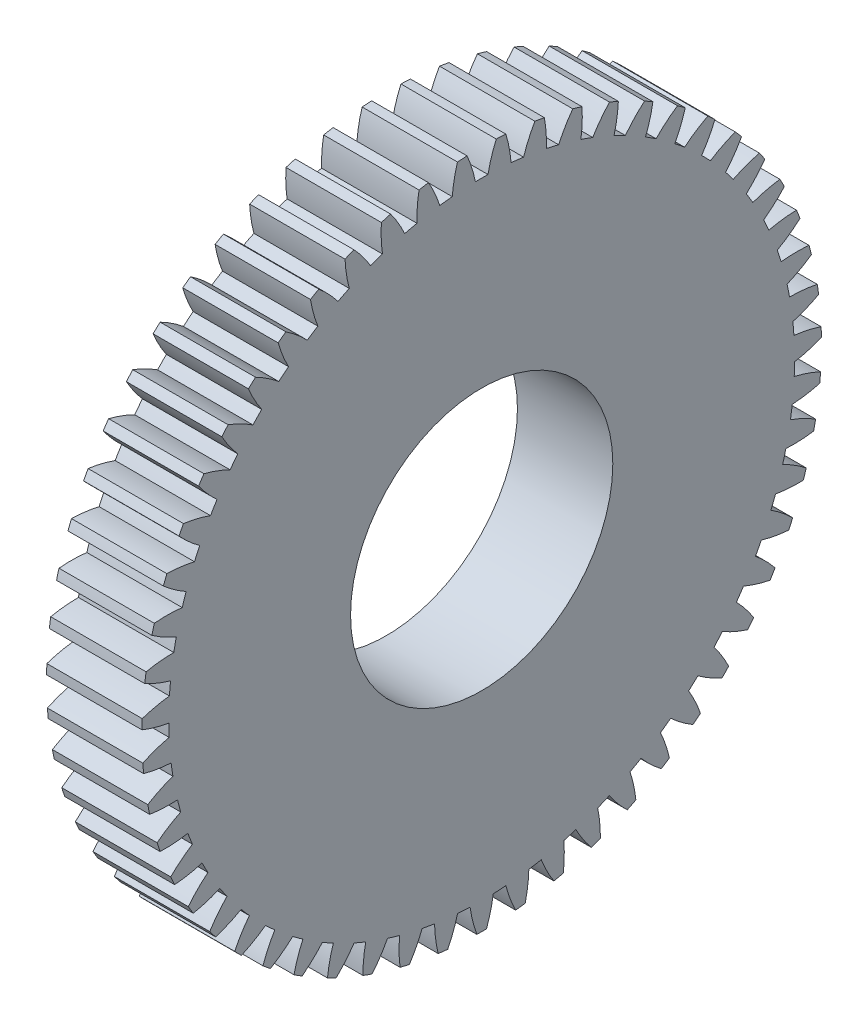
from build123d import *

# Parameters (mm, degrees)
BASPROSKE_W     = 4
BASPROSKE_H     = 14.25
TOOTHCUT_DEPTH  = 21.545680811
TEETHCUTS_COUNT = 55
TEETHCUTS_ANGLE = 353.454545455
BORSKE_R        = 5.5
BORE_DEPTH      = 50.0000508


with BuildPart() as part:
    # BasProSke → Base-Revolve (revolve)
    with BuildSketch(Plane(origin=(0, 0, 0), x_dir=(1, 0, 0), z_dir=(0, 1, 0)), mode=Mode.PRIVATE) as base_revolve_sk:
        with Locations((2, 7.125)):
            Rectangle(BASPROSKE_W, BASPROSKE_H)
    revolve(base_revolve_sk.sketch.rotate(Axis((-10, 0, 0), (1, 0, 0)), 180), axis=Axis((-10, 0, 0), (1, 0, 0)))

    # TooCutSke → ToothCut (cut, through all)
    with BuildSketch(Plane(origin=(0, 0, 0), x_dir=(0, 0, -1), z_dir=(1, 0, 0))):
        with BuildLine():
            ThreePointArc((0.264004038, 13.121344362), (0, 13.124), (-0.264004038, 13.121344362))
            ThreePointArc((-0.264004038, 13.121344362), (-0.412468683, 13.701356592), (-0.623098323, 14.261794895))
            ThreePointArc((-0.623098323, 14.261794895), (0, 14.2754), (0.623098323, 14.261794895))
            ThreePointArc((0.623098323, 14.261794895), (0.412468683, 13.701356592), (0.264004038, 13.121344362))
        make_face()
    toothcut = extrude(amount=TOOTHCUT_DEPTH, mode=Mode.SUBTRACT)

    # TeethCuts: ToothCut ×55 about axis
    teethcuts_axis = Axis((-10, 0, 0), (1, 0, 0))
    for i in range(1, TEETHCUTS_COUNT):
        add(toothcut.rotate(teethcuts_axis, i * TEETHCUTS_ANGLE / (TEETHCUTS_COUNT - 1)), mode=Mode.SUBTRACT)

    # BorSke → Bore (cut, symmetric)
    with BuildSketch(Plane(origin=(0, 0, 0), x_dir=(0, 0, -1), z_dir=(1, 0, 0))):
        with Locations(Location((0, 0, 0), (0, 0, 180))):
            Circle(BORSKE_R)
    extrude(amount=BORE_DEPTH, both=True, mode=Mode.SUBTRACT)


solid = part.part
